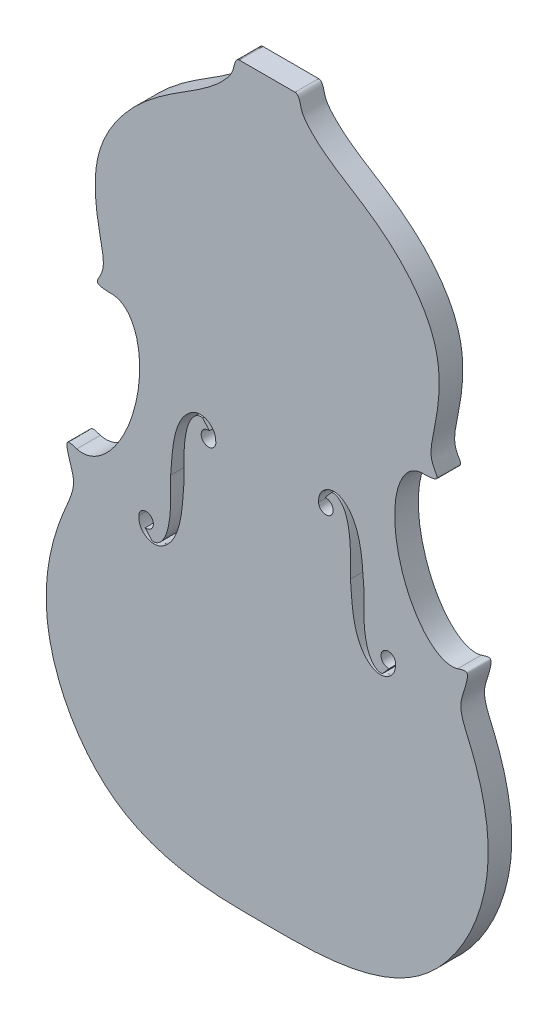
from build123d import *

# Parameters (mm, degrees)
BOSS_EXTRUDE1_DEPTH = 33.528
CUT_EXTRUDE1_DEPTH  = 639.459312863


with BuildPart() as part:
    # Sketch5 → Boss-Extrude1 (new body)
    with BuildSketch(Plane.XY):
        with BuildLine():
            Line((0, -554.967468443), (0, 489.229569363))
            Line((0, 489.229569363), (39.526005164, 489.229569363))
            add(Edge.make_bspline(
                [(39.526005164, 489.229569363), (41.994165882, 489.229569363), (46.580457916, 483.708971039), (47.762318429, 469.539805459), (74.770347257, 435.758695832), (127.346779033, 407.12922115), (196.147624771, 356.264111054), (250.121842796, 278.719817652), (243.79696391, 200.259757547), (231.400647678, 148.667774361), (233.206586123, 129.473919565), (246.106067893, 111.456905789), (223.550549609, 111.013477767), (219.991214235, 111.047612516)],
                knots=[0, 0, 0, 0, 0.004292658, 0.013712553, 0.029409302, 0.091800128, 0.139494611, 0.210642635, 0.278267171, 0.300684525, 0.318441442, 0.325161593, 0.331714411, 0.331714411, 0.331714411, 0.331714411], degree=3))
            add(Edge.make_bspline(
                [(219.991214235, 111.047612516), (159.68013229, 108.939830382), (186.55046225, -5.929613161), (213.42079221, -120.799056703), (270.371015496, -104.32375602)],
                knots=[3.030119447, 3.030119447, 3.030119447, 4.663495081, 4.663495081, 6.296870715, 6.296870715, 6.296870715], degree=2, weights=[1, 0.684639149, 1, 0.684639149, 1]))
            add(Edge.make_bspline(
                [(270.371015496, -104.32375602), (281.787258307, -100.433002015), (286.665344414, -102.974391332), (280.053446734, -125.948208538), (270.840593782, -151.662507255), (307.762242936, -226.693334601), (330.768683107, -359.325942549), (234.516639483, -526.575397488), (103.980282593, -554.029663017), (29.314144201, -555.029340186), (6.953884561, -554.967468443), (0, -554.967468443)],
                knots=[0.531515794, 0.531515794, 0.531515794, 0.531515794, 0.541192242, 0.555870224, 0.570209623, 0.600541868, 0.716993045, 0.84910038, 0.951451168, 0.984334692, 1, 1, 1, 1], degree=3))
        make_face()
    extrude(amount=-BOSS_EXTRUDE1_DEPTH)

    # Mirror1: part across plane


with BuildPart() as part_1:
    add(part.part)
    add(part.part.mirror(Plane(origin=(0, -554.967468443, -33.528), x_dir=(0, 0, 1), z_dir=(1, 0, 0))))

    # Sketch6 → Cut-Extrude1 (cut, symmetric)
    with BuildSketch(Plane.XY):
        with BuildLine():
            Line((82.113727821, 12.174569948), (91.495209228, 23.067456291))
            add(Edge.make_bspline(
                [(91.495209228, 23.067456291), (98.153433898, 24.845951504), (108.558989576, 15.332541884), (120.176618809, -17.523236673), (117.862673151, -47.477614072), (118.17449644, -70.270609514)],
                knots=[0, 0, 0, 0, 0.180443307, 0.343564803, 1, 1, 1, 1], degree=3))
            add(Edge.make_bspline(
                [(182.388371844, -142.404506938), (182.388371844, -146.643445815), (180.918718829, -156.46300891), (169.931369013, -165.599736606), (155.238801911, -167.283566927), (137.393499052, -156.46362673), (120.504626826, -122.12861591), (120.011549566, -90.588933586), (118.17449644, -70.270609514)],
                knots=[0, 0, 0, 0, 0.08267555, 0.195734727, 0.255854003, 0.372641988, 0.585943248, 1, 1, 1, 1], degree=3))
            ThreePointArc((182.388371844, -142.404506938), (164.239676355, -135.509522465), (173.231914763, -152.715788976))
            Line((173.231914763, -152.715788976), (163.850433356, -163.608675318))
            add(Edge.make_bspline(
                [(163.850433356, -163.608675318), (157.192208686, -165.387170532), (146.786653008, -155.873760912), (135.169023775, -123.017982355), (137.482969433, -93.063604956), (137.171146144, -70.270609514)],
                knots=[0, 0, 0, 0, 0.180443307, 0.343564803, 1, 1, 1, 1], degree=3))
            add(Edge.make_bspline(
                [(72.95727074, 1.86328791), (72.95727074, 6.102226787), (74.426923755, 15.921789883), (85.414273571, 25.058517578), (100.106840673, 26.742347899), (117.952143532, 15.922407702), (134.841015758, -18.412603117), (135.334093018, -49.952285442), (137.171146144, -70.270609514)],
                knots=[0, 0, 0, 0, 0.08267555, 0.195734727, 0.255854003, 0.372641988, 0.585943248, 1, 1, 1, 1], degree=3))
            ThreePointArc((72.95727074, 1.86328791), (91.10596623, -5.031696563), (82.113727821, 12.174569948))
        make_face()
    cut_extrude1 = extrude(amount=CUT_EXTRUDE1_DEPTH, both=True, mode=Mode.SUBTRACT)

    # Mirror3: Cut-Extrude1 across plane
    add(cut_extrude1.mirror(Plane(origin=(0, 0, 0), x_dir=(0, 0, 1), z_dir=(1, 0, 0))), mode=Mode.SUBTRACT)


solid = part_1.part
